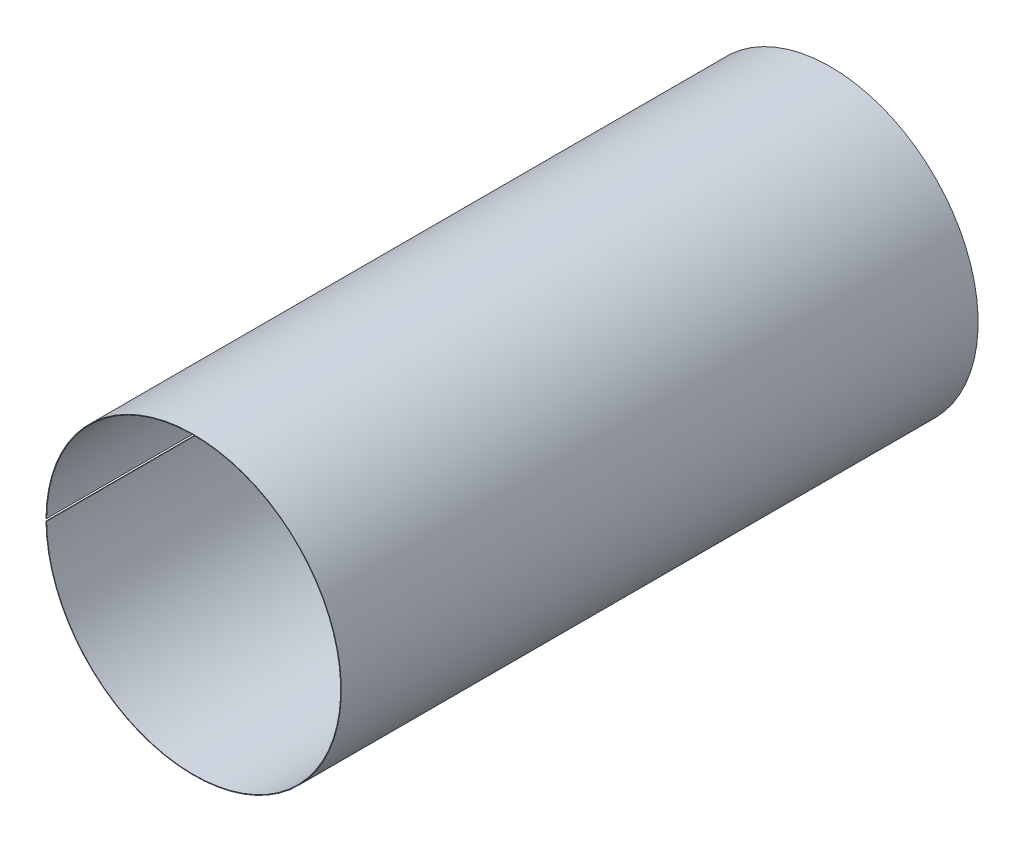
from build123d import *

# Parameters (mm, degrees)
SKETCH2_R               = 64.77
SKETCH2_R_2             = 64.516
BOSS_EXTRUDE1_DEPTH     = 279.4
CUT_EXTRUDE1_REACH      = 316.706
CUT_EXTRUDE1_END_RADIUS = 64.516
SKETCH5_W               = 279.4
SKETCH5_H               = 1.016


with BuildPart() as part:
    # Sketch2 → Boss-Extrude1 (new body)
    with BuildSketch(Plane.XY):
        Circle(SKETCH2_R)
        Circle(SKETCH2_R_2, mode=Mode.SUBTRACT)
    extrude(amount=BOSS_EXTRUDE1_DEPTH)

    # Cut-Extrude1: up to this cylinder (the profile starts outside it)
    cut_extrude1_end = Plane(origin=(0, 0, 139.7), z_dir=(0, 0, -1)) * Cylinder(CUT_EXTRUDE1_END_RADIUS, 763.444, mode=Mode.PRIVATE)
    # Sketch5 → Cut-Extrude1 (cut, up to the surface)
    with BuildSketch(Plane.ZY.offset(64.77), mode=Mode.PRIVATE) as cut_extrude1_sk1:
        with Locations((139.7, 0)):
            Rectangle(SKETCH5_W, SKETCH5_H)
    cut_extrude1_tool1 = extrude(cut_extrude1_sk1.sketch, amount=-CUT_EXTRUDE1_REACH, mode=Mode.PRIVATE) - cut_extrude1_end
    add(cut_extrude1_tool1.solids().sort_by_distance((-64.77, 0, 139.7))[0], mode=Mode.SUBTRACT)


solid = part.part
